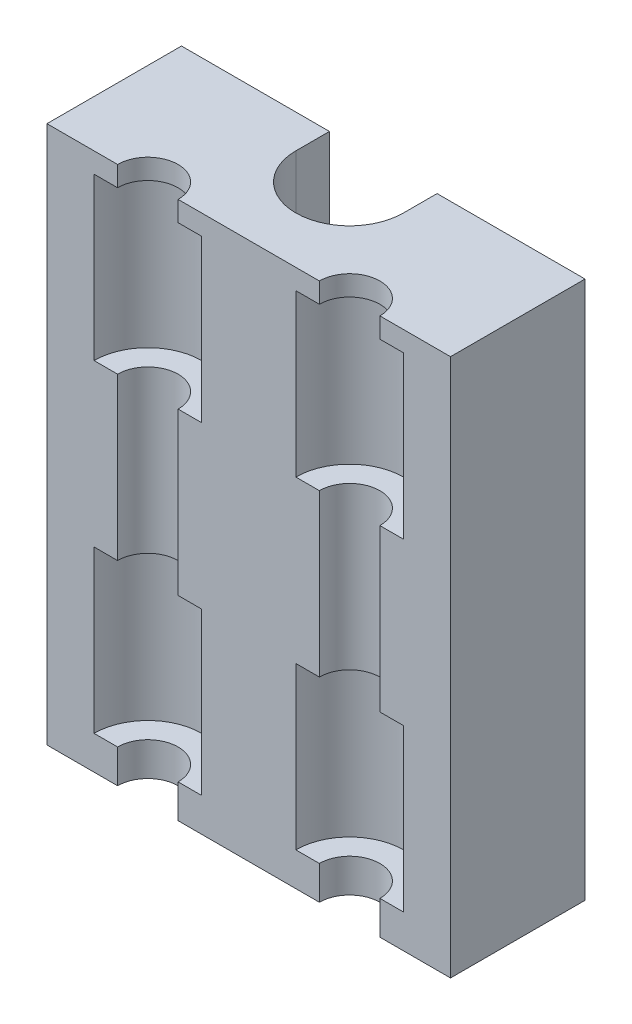
from build123d import *

# Parameters (mm, degrees)
SKETCH_1_W               = 30
SKETCH_1_H               = 10
EXTRUDE_1_DEPTH          = 40
CUT_EXTRUDE_START        = -1.5
SKETCH_2_R               = 4
CUT_EXTRUDE_1_DEPTH      = 12
CUT_EXTRUDE_START_2      = -12
CUT_EXTRUDE_2_DEPTH      = 12
CUT_EXTRUDE_3_DEPTH      = 33.050741021
CUT_EXTRUDE_3_DEPTH_BACK = 33.050741021
SKETCH_4_R               = 2.25
CUT_EXTRUDE_4_DEPTH      = 44.874821937


with BuildPart() as part:
    # 草图1 → 凸台-拉伸1 (new body)
    with BuildSketch(Plane(origin=(0, 0, 0), x_dir=(1, 0, 0), z_dir=(0, 1, 0))):
        with Locations((0, 5)):
            Rectangle(SKETCH_1_W, SKETCH_1_H)
    extrude(amount=-EXTRUDE_1_DEPTH)

    # 草图2 → 切除-拉伸1 (cut)
    with BuildSketch(Plane(origin=(0, 0, 0), x_dir=(1, 0, 0), z_dir=(0, 1, 0)).offset(CUT_EXTRUDE_START)):
        with Locations((-7.5, 0)):
            Circle(SKETCH_2_R)
        with Locations((7.5, 0)):
            Circle(SKETCH_2_R)
    extrude(amount=-CUT_EXTRUDE_1_DEPTH, mode=Mode.SUBTRACT)

    # 草图3 → 切除-拉伸2 (cut)
    with BuildSketch(Plane(origin=(0, -13.5, 0), x_dir=(1, 0, 0), z_dir=(0, 1, 0)).offset(CUT_EXTRUDE_START_2)):
        with BuildLine():
            Line((-11.5, 0), (-3.5, 0))
            ThreePointArc((-3.5, 0), (-7.5, 4), (-11.5, 0))
        make_face()
        with BuildLine():
            Line((3.5, 0), (11.5, 0))
            ThreePointArc((11.5, 0), (7.5, 4), (3.5, 0))
        make_face()
    extrude(amount=-CUT_EXTRUDE_2_DEPTH, mode=Mode.SUBTRACT)

    # 草图4 → 切除-拉伸3 (cut, two sides: drawn at the far end of the back side and taken through both)
    with BuildSketch(Plane(origin=(0, -13.5, 0), x_dir=(1, 0, 0), z_dir=(0, 1, 0)).offset(-CUT_EXTRUDE_3_DEPTH_BACK)):
        with Locations((-7.5, 0)):
            Circle(SKETCH_4_R)
        with Locations((7.5, 0)):
            Circle(SKETCH_4_R)
    extrude(amount=CUT_EXTRUDE_3_DEPTH + CUT_EXTRUDE_3_DEPTH_BACK, mode=Mode.SUBTRACT)

    # 草图5 → 切除-拉伸4 (cut, through all)
    with BuildSketch(Plane(origin=(0, 0, 0), x_dir=(1, 0, 0), z_dir=(0, 1, 0))):
        with BuildLine():
            Line((-4, 7.5), (-4, 10))
            ThreePointArc((-4, 10), (0, 14), (4, 10))
            Line((4, 10), (4, 7.5))
            ThreePointArc((4, 7.5), (0, 3.5), (-4, 7.5))
        make_face()
    extrude(amount=-CUT_EXTRUDE_4_DEPTH, mode=Mode.SUBTRACT)


solid = part.part
